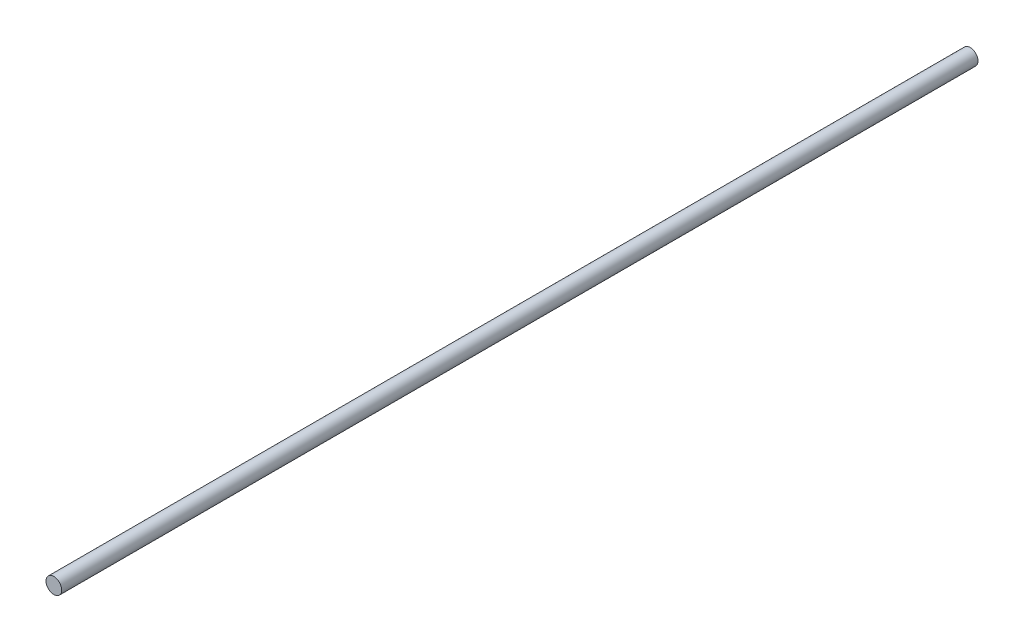
from build123d import *

# Parameters (mm, degrees)
SKETCH1_R           = 3.175
BOSS_EXTRUDE1_DEPTH = 370.84


with BuildPart() as part:
    # Sketch1 → Boss-Extrude1 (new body)
    with BuildSketch(Plane.XY):
        with Locations(Location((0, 0, 0), (0, 0, 180))):
            Circle(SKETCH1_R)
    extrude(amount=BOSS_EXTRUDE1_DEPTH)


solid = part.part
